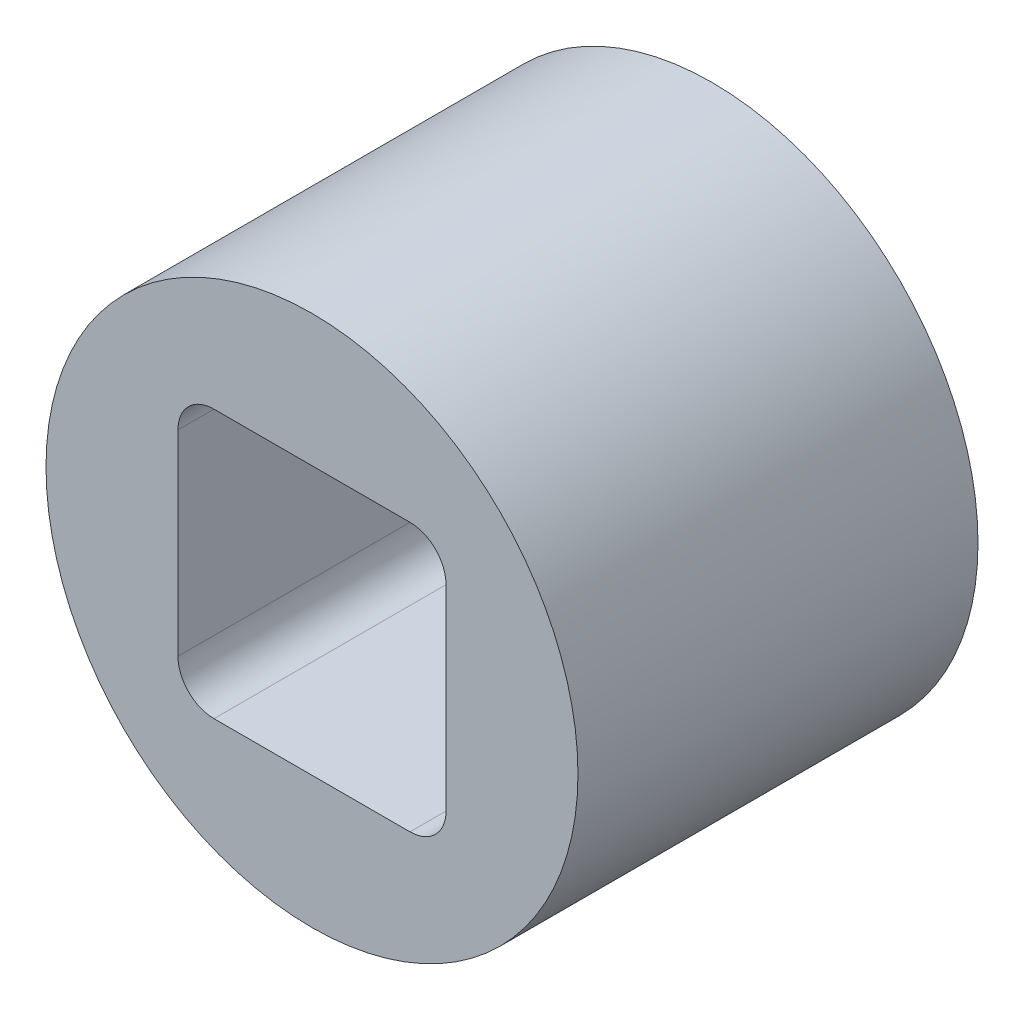
from build123d import *

# Parameters (mm, degrees)
SKETCH1_R           = 3.175
SKETCH1_W           = 3.2
SKETCH1_H           = 3.2
BOSS_EXTRUDE1_DEPTH = 4.7752
FILLET1_R           = 0.43


with BuildPart() as part:
    # Sketch1 → Boss-Extrude1 (new body)
    with BuildSketch(Plane.XY):
        Circle(SKETCH1_R)
        Rectangle(SKETCH1_W, SKETCH1_H, mode=Mode.SUBTRACT)
    extrude(amount=BOSS_EXTRUDE1_DEPTH)

    # Fillet1
    fillet1_edges = [part.edges().sort_by_distance(p)[0] for p in [
        (1.6, -1.6, 2.3876),
        (1.6, 1.6, 2.3876),
        (-1.6, 1.6, 2.3876),
        (-1.6, -1.6, 2.3876),
    ]]
    fillet(fillet1_edges, radius=FILLET1_R)


solid = part.part
